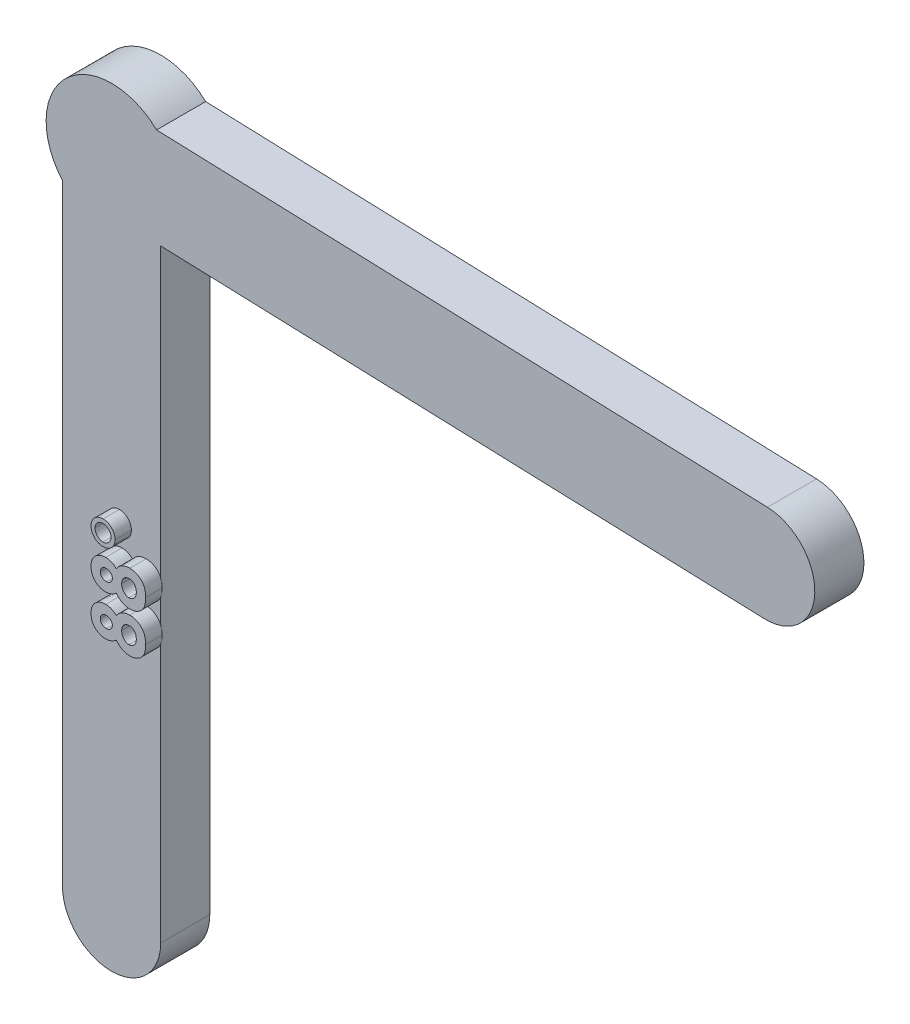
from build123d import *

# Parameters (mm, degrees)
BOSS_EXTRUDE1_DEPTH = 3
BOSS_EXTRUDE2_DEPTH = 1


with BuildPart() as part:
    # Sketch2 → Boss-Extrude1 (new body)
    with BuildSketch(Plane.XY):
        with BuildLine():
            Line((-3, -40), (-3, -2.645751311))
            ThreePointArc((-3, -2.645751311), (-2.778633482, 2.877359201), (2.748838081, 2.905837092))
            Line((2.748838081, 2.905837092), (40.080331571, 1.602192613))
            ThreePointArc((40.080331571, 1.602192613), (42.973805562, -1.500678358), (39.870934591, -4.394152349))
            Line((39.870934591, -4.394152349), (3, -3.106590941))
            Line((3, -3.106590941), (3, -40))
            ThreePointArc((3, -40), (0, -43), (-3, -40))
        make_face()
    extrude(amount=BOSS_EXTRUDE1_DEPTH)

    # Sketch3 → Boss-Extrude2 (add)
    # profile 1 of 3: a face of its own
    with BuildSketch(Plane.XY.offset(3)):
        with BuildLine():
            add(Edge.make_bspline(
                [(1.290384615, -23.026312298), (1.314166509, -22.993008974), (1.361240621, -22.927088051), (1.445595377, -22.840312384), (1.539140341, -22.764908234), (1.642399085, -22.703054927), (1.752431528, -22.653094384), (1.868089089, -22.617736659), (1.988052111, -22.594977779), (2.069615292, -22.592519139), (2.110847356, -22.59127624)],
                knots=[0, 0, 0, 0, 1.013621193, 2.006371702, 2.99000395, 3.985409788, 4.983103806, 5.979189713, 6.978433935, 8, 8, 8, 8], degree=3))
            add(Edge.make_bspline(
                [(2.110847356, -22.59127624), (2.155493061, -22.592781497), (2.244042089, -22.595766983), (2.373883227, -22.622228362), (2.498505826, -22.664489075), (2.616432852, -22.722790764), (2.724431839, -22.795543989), (2.820760825, -22.879876944), (2.901500204, -22.977055898), (2.956541404, -23.067179102), (2.992613836, -23.145046893), (3.017147677, -23.207283527), (3.036374539, -23.273881176), (3.053202037, -23.343847379), (3.065563353, -23.418056754), (3.075401317, -23.495886787), (3.080155908, -23.577892248), (3.08098502, -23.633704691), (3.081410256, -23.662329926)],
                knots=[0, 0, 0, 0, 1.313695232, 2.605545886, 3.885009818, 5.18064216, 6.467307036, 7.710187626, 8.938110693, 10.173834898, 10.807905002, 11.46418112, 12.141763502, 12.847499418, 13.582459421, 14.356129027, 15.156887083, 16, 16, 16, 16], degree=3))
            add(Edge.make_bspline(
                [(3.081410256, -23.662329926), (3.080993787, -23.692863796), (3.080180505, -23.752490423), (3.075321583, -23.839540967), (3.066194522, -23.921622372), (3.054699341, -23.99910139), (3.037672832, -24.071285294), (3.018972292, -24.139263577), (2.996206942, -24.202310994), (2.960636755, -24.279023169), (2.907185797, -24.367493207), (2.828023569, -24.462370692), (2.734597618, -24.546705576), (2.627697323, -24.618514286), (2.509788283, -24.676430737), (2.383511061, -24.71879451), (2.249446964, -24.744074642), (2.157597072, -24.747105427), (2.110847356, -24.748648035)],
                knots=[0, 0, 0, 0, 0.887120363, 1.732371145, 2.531576131, 3.285973923, 4.006155245, 4.684676743, 5.333503306, 5.950809733, 7.13915648, 8.324434623, 9.528022799, 10.783613014, 12.053458699, 13.333110172, 14.642607612, 16, 16, 16, 16], degree=3))
            add(Edge.make_bspline(
                [(2.110847356, -24.748648035), (2.070068436, -24.747233147), (1.989932921, -24.744452722), (1.872494733, -24.724594426), (1.761018818, -24.690327971), (1.654672452, -24.643827956), (1.553870674, -24.583518012), (1.459741575, -24.508877523), (1.370281849, -24.421927441), (1.317458785, -24.355782454), (1.290384615, -24.321880206)],
                knots=[0, 0, 0, 0, 1.018125035, 2.000738969, 2.963689272, 3.92372463, 4.892478514, 5.887985778, 6.917498794, 8, 8, 8, 8], degree=3))
            add(Edge.make_bspline(
                [(1.290384615, -24.321880206), (1.266151716, -24.342893833), (1.218444435, -24.384263335), (1.141646952, -24.437762229), (1.062364505, -24.483056938), (0.981097768, -24.521025414), (0.89711666, -24.549380641), (0.811521784, -24.57095544), (0.723184578, -24.582965773), (0.663516636, -24.584867142), (0.633378405, -24.585827522)],
                knots=[0, 0, 0, 0, 1.061588578, 2.089948196, 3.093099862, 4.082597858, 5.055037947, 6.023898163, 7.001872498, 8, 8, 8, 8], degree=3))
            add(Edge.make_bspline(
                [(0.633378405, -24.585827522), (0.592576327, -24.584567419), (0.512075397, -24.582081284), (0.394207452, -24.559799021), (0.28205246, -24.523313199), (0.176290436, -24.473083604), (0.079075037, -24.409879466), (-0.007396026, -24.333735576), (-0.081993722, -24.245932944), (-0.145475268, -24.147619637), (-0.195029291, -24.038917015), (-0.230531324, -23.921499145), (-0.252811348, -23.796100346), (-0.25519237, -23.709702335), (-0.256410256, -23.665510014)],
                knots=[0, 0, 0, 0, 1.02226196, 2.016883474, 2.9952073, 3.972418565, 4.944004294, 5.893096802, 6.850754418, 7.823909284, 8.818133006, 9.835407617, 10.892817559, 12, 12, 12, 12], degree=3))
            add(Edge.make_bspline(
                [(-0.256410256, -23.665510014), (-0.255190422, -23.621954272), (-0.252812, -23.537029695), (-0.230679106, -23.413833393), (-0.194395909, -23.298961942), (-0.143773179, -23.192659656), (-0.08015754, -23.095369151), (-0.003012872, -23.009068937), (0.085649386, -22.933160951), (0.185372183, -22.869432052), (0.292865784, -22.818185328), (0.405795355, -22.780740272), (0.522920147, -22.758782336), (0.602336048, -22.755664859), (0.642282652, -22.754096753)],
                knots=[0, 0, 0, 0, 1.094451292, 2.133950859, 3.135435022, 4.115505557, 5.085475983, 6.048403322, 7.01637925, 8.011600517, 9.015508126, 10.003420448, 10.995710276, 12, 12, 12, 12], degree=3))
            add(Edge.make_bspline(
                [(0.642282652, -22.754096753), (0.670513068, -22.754855448), (0.725913147, -22.75634433), (0.807533099, -22.767352823), (0.885847553, -22.785889774), (0.962749047, -22.811734482), (1.040327423, -22.847667448), (1.120069223, -22.896293105), (1.205287736, -22.955439833), (1.261061511, -23.001890713), (1.290384615, -23.026312298)],
                knots=[0, 0, 0, 0, 0.940746401, 1.846144481, 2.739104268, 3.619506754, 4.545839139, 5.581956076, 6.728711598, 8, 8, 8, 8], degree=3))
        make_face()
        with BuildLine():
            add(Edge.make_bspline(
                [(0.313461538, -23.679502402), (0.314577296, -23.702973319), (0.316747691, -23.748629438), (0.336791099, -23.813541523), (0.368396801, -23.872433315), (0.413289247, -23.923114863), (0.468001453, -23.964250594), (0.530415435, -23.994987219), (0.600152328, -24.013045), (0.648960581, -24.014966618), (0.674083534, -24.015955727)],
                knots=[0, 0, 0, 0, 1.01773081, 1.979711282, 2.923920718, 3.903393177, 4.896680191, 5.881555186, 6.909578104, 8, 8, 8, 8], degree=3))
            add(Edge.make_bspline(
                [(0.674083534, -24.015955727), (0.699424417, -24.01473849), (0.748904934, -24.012361717), (0.819934691, -23.993640737), (0.884396564, -23.961808124), (0.940626067, -23.917742023), (0.987659679, -23.865222688), (1.021570733, -23.804874205), (1.04308292, -23.738821656), (1.045116089, -23.692389641), (1.046153846, -23.668690102)],
                knots=[0, 0, 0, 0, 1.070748338, 2.090739333, 3.08117878, 4.090911184, 5.094654374, 6.042199979, 7.000711936, 8, 8, 8, 8], degree=3))
            add(Edge.make_bspline(
                [(1.046153846, -23.668690102), (1.045059816, -23.644589035), (1.042928441, -23.597635633), (1.022508887, -23.530660856), (0.988689983, -23.470865504), (0.94229789, -23.419403424), (0.886359471, -23.376357543), (0.820898298, -23.345507755), (0.747532717, -23.327585015), (0.696233661, -23.325203523), (0.66963141, -23.323968548)],
                knots=[0, 0, 0, 0, 1.009150293, 1.966014103, 2.906107826, 3.870180916, 4.854078599, 5.848854597, 6.884476363, 8, 8, 8, 8], degree=3))
            add(Edge.make_bspline(
                [(0.66963141, -23.323968548), (0.644523092, -23.325237857), (0.595964488, -23.327692656), (0.526250213, -23.345294507), (0.464864053, -23.377621187), (0.410961323, -23.420094273), (0.367492124, -23.473344141), (0.335524613, -23.535163337), (0.316983147, -23.605096651), (0.314660828, -23.654163397), (0.313461538, -23.679502402)],
                knots=[0, 0, 0, 0, 1.065910571, 2.061433587, 3.023559535, 3.990682701, 4.956464619, 5.918590567, 6.925120432, 8, 8, 8, 8], degree=3))
        make_face(mode=Mode.SUBTRACT)
        with BuildLine():
            add(Edge.make_bspline(
                [(1.616025641, -23.661057891), (1.616315036, -23.678890032), (1.616885429, -23.71403696), (1.623711201, -23.765668253), (1.633401384, -23.815418524), (1.648498508, -23.86241607), (1.666134775, -23.907905955), (1.689165374, -23.950739891), (1.715918448, -23.991651788), (1.74640318, -24.029758844), (1.779830517, -24.064209477), (1.814702344, -24.095260775), (1.851910211, -24.12064149), (1.890219827, -24.141777404), (1.929934133, -24.158760273), (1.971707306, -24.169987223), (2.014983002, -24.17721581), (2.044460653, -24.178253037), (2.059329928, -24.17877624)],
                knots=[0, 0, 0, 0, 1.129662435, 2.226550525, 3.296682235, 4.33815786, 5.351414921, 6.385493299, 7.41431807, 8.4469981, 9.473537958, 10.454642902, 11.401552439, 12.321859429, 13.225429467, 14.131893492, 15.057679712, 16, 16, 16, 16], degree=3))
            add(Edge.make_bspline(
                [(2.059329928, -24.17877624), (2.074837113, -24.178526872), (2.105593696, -24.178032281), (2.150485415, -24.170562185), (2.193780386, -24.159806562), (2.235073386, -24.14469996), (2.274340207, -24.124497697), (2.311963245, -24.100376027), (2.347676229, -24.071492898), (2.381297203, -24.038635081), (2.411600958, -24.001839599), (2.438404735, -23.962224083), (2.461677906, -23.920046731), (2.479861546, -23.874906877), (2.49411916, -23.826983606), (2.503888336, -23.776485051), (2.510720881, -23.72314812), (2.511261264, -23.686733504), (2.511538462, -23.668054084)],
                knots=[0, 0, 0, 0, 0.973751152, 1.931314908, 2.852573969, 3.776047714, 4.688004804, 5.623328242, 6.580799242, 7.570383313, 8.573782212, 9.57185612, 10.573837789, 11.596003268, 12.62492379, 13.712263769, 14.826471634, 16, 16, 16, 16], degree=3))
            add(Edge.make_bspline(
                [(2.511538462, -23.668054084), (2.511196157, -23.649169628), (2.510529115, -23.612369803), (2.504633754, -23.558575838), (2.495279457, -23.507696372), (2.481900889, -23.459791822), (2.464761533, -23.414682299), (2.442949692, -23.372968368), (2.418219634, -23.333714205), (2.389368786, -23.298121162), (2.357892778, -23.265910593), (2.323956282, -23.237529703), (2.287463312, -23.213770107), (2.248401199, -23.194887945), (2.207627439, -23.179355669), (2.164524234, -23.168555886), (2.119106345, -23.162037403), (2.087973171, -23.16144898), (2.07205028, -23.161148035)],
                knots=[0, 0, 0, 0, 1.200550576, 2.339492856, 3.436821733, 4.486835684, 5.498320788, 6.499238723, 7.475334368, 8.44385928, 9.406737867, 10.335409062, 11.251568017, 12.168024507, 13.089524389, 14.021419298, 14.988065767, 16, 16, 16, 16], degree=3))
            add(Edge.make_bspline(
                [(2.07205028, -23.161148035), (2.056133401, -23.161729858), (2.025021417, -23.162867119), (1.979077259, -23.16909005), (1.935521469, -23.180763628), (1.893343926, -23.196036093), (1.853417246, -23.21635192), (1.81582637, -23.241573801), (1.779637539, -23.270281659), (1.746471676, -23.303838066), (1.716116677, -23.340514587), (1.689182565, -23.379595701), (1.666011589, -23.420681204), (1.64851655, -23.464780182), (1.633396343, -23.510493081), (1.62371115, -23.558984292), (1.616884013, -23.609345873), (1.616314611, -23.643649093), (1.616025641, -23.661057891)],
                knots=[0, 0, 0, 0, 1.011783362, 1.977685852, 2.938313235, 3.871729441, 4.823627117, 5.776382316, 6.744161804, 7.753880392, 8.768082256, 9.765777265, 10.766741032, 11.757408326, 12.775628261, 13.821889533, 14.89461443, 16, 16, 16, 16], degree=3))
        make_face(mode=Mode.SUBTRACT)
    # profile 2 of 3: a face of its own
    with BuildSketch(Plane.XY.offset(3)):
        with BuildLine():
            add(Edge.make_bspline(
                [(1.290384615, -20.543299477), (1.314166509, -20.509996154), (1.361240621, -20.44407523), (1.445595377, -20.357299563), (1.539140341, -20.281895414), (1.642399085, -20.220042107), (1.752431528, -20.170081563), (1.868089089, -20.134723838), (1.988052111, -20.111964958), (2.069615292, -20.109506318), (2.110847356, -20.108263419)],
                knots=[0, 0, 0, 0, 1.013621193, 2.006371702, 2.99000395, 3.985409788, 4.983103806, 5.979189713, 6.978433935, 8, 8, 8, 8], degree=3))
            add(Edge.make_bspline(
                [(2.110847356, -20.108263419), (2.155493061, -20.109768677), (2.244042089, -20.112754162), (2.373883227, -20.139215541), (2.498505826, -20.181476255), (2.616432852, -20.239777943), (2.724431839, -20.312531169), (2.820760825, -20.396864123), (2.901500204, -20.494043078), (2.956541404, -20.584166281), (2.992613836, -20.662034073), (3.017147677, -20.724270707), (3.036374539, -20.790868356), (3.053202037, -20.860834558), (3.065563353, -20.935043934), (3.075401317, -21.012873967), (3.080155908, -21.094879427), (3.08098502, -21.150691871), (3.081410256, -21.179317105)],
                knots=[0, 0, 0, 0, 1.313695232, 2.605545886, 3.885009818, 5.18064216, 6.467307036, 7.710187626, 8.938110693, 10.173834898, 10.807905002, 11.46418112, 12.141763502, 12.847499418, 13.582459421, 14.356129027, 15.156887083, 16, 16, 16, 16], degree=3))
            add(Edge.make_bspline(
                [(3.081410256, -21.179317105), (3.080993787, -21.209850975), (3.080180505, -21.269477602), (3.075321583, -21.356528146), (3.066194522, -21.438609551), (3.054699341, -21.51608857), (3.037672832, -21.588272474), (3.018972292, -21.656250757), (2.996206942, -21.719298173), (2.960636755, -21.796010348), (2.907185797, -21.884480386), (2.828023569, -21.979357872), (2.734597618, -22.063692755), (2.627697323, -22.135501465), (2.509788283, -22.193417916), (2.383511061, -22.235781689), (2.249446964, -22.261061822), (2.157597072, -22.264092607), (2.110847356, -22.265635214)],
                knots=[0, 0, 0, 0, 0.887120363, 1.732371145, 2.531576131, 3.285973923, 4.006155245, 4.684676743, 5.333503306, 5.950809733, 7.13915648, 8.324434623, 9.528022799, 10.783613014, 12.053458699, 13.333110172, 14.642607612, 16, 16, 16, 16], degree=3))
            add(Edge.make_bspline(
                [(2.110847356, -22.265635214), (2.070068436, -22.264220327), (1.989932921, -22.261439901), (1.872494733, -22.241581605), (1.761018818, -22.20731515), (1.654672452, -22.160815136), (1.553870674, -22.100505192), (1.459741575, -22.025864702), (1.370281849, -21.938914621), (1.317458785, -21.872769633), (1.290384615, -21.838867386)],
                knots=[0, 0, 0, 0, 1.018125035, 2.000738969, 2.963689272, 3.92372463, 4.892478514, 5.887985778, 6.917498794, 8, 8, 8, 8], degree=3))
            add(Edge.make_bspline(
                [(1.290384615, -21.838867386), (1.266151716, -21.859881012), (1.218444435, -21.901250514), (1.141646952, -21.954749408), (1.062364505, -22.000044117), (0.981097768, -22.038012593), (0.89711666, -22.06636782), (0.811521784, -22.087942619), (0.723184578, -22.099952953), (0.663516636, -22.101854322), (0.633378405, -22.102814701)],
                knots=[0, 0, 0, 0, 1.061588578, 2.089948196, 3.093099862, 4.082597858, 5.055037947, 6.023898163, 7.001872498, 8, 8, 8, 8], degree=3))
            add(Edge.make_bspline(
                [(0.633378405, -22.102814701), (0.592576327, -22.101554598), (0.512075397, -22.099068463), (0.394207452, -22.0767862), (0.28205246, -22.040300379), (0.176290436, -21.990070784), (0.079075037, -21.926866646), (-0.007396026, -21.850722756), (-0.081993722, -21.762920124), (-0.145475268, -21.664606816), (-0.195029291, -21.555904195), (-0.230531324, -21.438486325), (-0.252811348, -21.313087526), (-0.25519237, -21.226689514), (-0.256410256, -21.182497193)],
                knots=[0, 0, 0, 0, 1.02226196, 2.016883474, 2.9952073, 3.972418565, 4.944004294, 5.893096802, 6.850754418, 7.823909284, 8.818133006, 9.835407617, 10.892817559, 12, 12, 12, 12], degree=3))
            add(Edge.make_bspline(
                [(-0.256410256, -21.182497193), (-0.255190422, -21.138941451), (-0.252812, -21.054016874), (-0.230679106, -20.930820572), (-0.194395909, -20.815949122), (-0.143773179, -20.709646835), (-0.08015754, -20.61235633), (-0.003012872, -20.526056117), (0.085649386, -20.45014813), (0.185372183, -20.386419232), (0.292865784, -20.335172507), (0.405795355, -20.297727452), (0.522920147, -20.275769515), (0.602336048, -20.272652039), (0.642282652, -20.271083932)],
                knots=[0, 0, 0, 0, 1.094451292, 2.133950859, 3.135435022, 4.115505557, 5.085475983, 6.048403322, 7.01637925, 8.011600517, 9.015508126, 10.003420448, 10.995710276, 12, 12, 12, 12], degree=3))
            add(Edge.make_bspline(
                [(0.642282652, -20.271083932), (0.670513068, -20.271842627), (0.725913147, -20.273331509), (0.807533099, -20.284340002), (0.885847553, -20.302876954), (0.962749047, -20.328721661), (1.040327423, -20.364654627), (1.120069223, -20.413280285), (1.205287736, -20.472427012), (1.261061511, -20.518877892), (1.290384615, -20.543299477)],
                knots=[0, 0, 0, 0, 0.940746401, 1.846144481, 2.739104268, 3.619506754, 4.545839139, 5.581956076, 6.728711598, 8, 8, 8, 8], degree=3))
        make_face()
        with BuildLine():
            add(Edge.make_bspline(
                [(0.313461538, -21.196489581), (0.314577296, -21.219960498), (0.316747691, -21.265616618), (0.336791099, -21.330528702), (0.368396801, -21.389420495), (0.413289247, -21.440102042), (0.468001453, -21.481237774), (0.530415435, -21.511974398), (0.600152328, -21.53003218), (0.648960581, -21.531953797), (0.674083534, -21.532942907)],
                knots=[0, 0, 0, 0, 1.01773081, 1.979711282, 2.923920718, 3.903393177, 4.896680191, 5.881555186, 6.909578104, 8, 8, 8, 8], degree=3))
            add(Edge.make_bspline(
                [(0.674083534, -21.532942907), (0.699424417, -21.531725669), (0.748904934, -21.529348897), (0.819934691, -21.510627917), (0.884396564, -21.478795303), (0.940626067, -21.434729202), (0.987659679, -21.382209868), (1.021570733, -21.321861385), (1.04308292, -21.255808835), (1.045116089, -21.209376821), (1.046153846, -21.185677282)],
                knots=[0, 0, 0, 0, 1.070748338, 2.090739333, 3.08117878, 4.090911184, 5.094654374, 6.042199979, 7.000711936, 8, 8, 8, 8], degree=3))
            add(Edge.make_bspline(
                [(1.046153846, -21.185677282), (1.045059816, -21.161576214), (1.042928441, -21.114622813), (1.022508887, -21.047648035), (0.988689983, -20.987852684), (0.94229789, -20.936390604), (0.886359471, -20.893344723), (0.820898298, -20.862494934), (0.747532717, -20.844572194), (0.696233661, -20.842190702), (0.66963141, -20.840955727)],
                knots=[0, 0, 0, 0, 1.009150293, 1.966014103, 2.906107826, 3.870180916, 4.854078599, 5.848854597, 6.884476363, 8, 8, 8, 8], degree=3))
            add(Edge.make_bspline(
                [(0.66963141, -20.840955727), (0.644523092, -20.842225036), (0.595964488, -20.844679836), (0.526250213, -20.862281686), (0.464864053, -20.894608366), (0.410961323, -20.937081453), (0.367492124, -20.99033132), (0.335524613, -21.052150516), (0.316983147, -21.12208383), (0.314660828, -21.171150577), (0.313461538, -21.196489581)],
                knots=[0, 0, 0, 0, 1.065910571, 2.061433587, 3.023559535, 3.990682701, 4.956464619, 5.918590567, 6.925120432, 8, 8, 8, 8], degree=3))
        make_face(mode=Mode.SUBTRACT)
        with BuildLine():
            add(Edge.make_bspline(
                [(1.616025641, -21.17804507), (1.616315036, -21.195877211), (1.616885429, -21.231024139), (1.623711201, -21.282655433), (1.633401384, -21.332405703), (1.648498508, -21.379403249), (1.666134775, -21.424893135), (1.689165374, -21.467727071), (1.715918448, -21.508638967), (1.74640318, -21.546746023), (1.779830517, -21.581196657), (1.814702344, -21.612247955), (1.851910211, -21.63762867), (1.890219827, -21.658764583), (1.929934133, -21.675747453), (1.971707306, -21.686974403), (2.014983002, -21.69420299), (2.044460653, -21.695240216), (2.059329928, -21.695763419)],
                knots=[0, 0, 0, 0, 1.129662435, 2.226550525, 3.296682235, 4.33815786, 5.351414921, 6.385493299, 7.41431807, 8.4469981, 9.473537958, 10.454642902, 11.401552439, 12.321859429, 13.225429467, 14.131893492, 15.057679712, 16, 16, 16, 16], degree=3))
            add(Edge.make_bspline(
                [(2.059329928, -21.695763419), (2.074837113, -21.695514051), (2.105593696, -21.695019461), (2.150485415, -21.687549364), (2.193780386, -21.676793741), (2.235073386, -21.661687139), (2.274340207, -21.641484876), (2.311963245, -21.617363206), (2.347676229, -21.588480078), (2.381297203, -21.555622261), (2.411600958, -21.518826779), (2.438404735, -21.479211262), (2.461677906, -21.437033911), (2.479861546, -21.391894056), (2.49411916, -21.343970785), (2.503888336, -21.29347223), (2.510720881, -21.2401353), (2.511261264, -21.203720684), (2.511538462, -21.185041264)],
                knots=[0, 0, 0, 0, 0.973751152, 1.931314908, 2.852573969, 3.776047714, 4.688004804, 5.623328242, 6.580799242, 7.570383313, 8.573782212, 9.57185612, 10.573837789, 11.596003268, 12.62492379, 13.712263769, 14.826471634, 16, 16, 16, 16], degree=3))
            add(Edge.make_bspline(
                [(2.511538462, -21.185041264), (2.511196157, -21.166156807), (2.510529115, -21.129356982), (2.504633754, -21.075563017), (2.495279457, -21.024683551), (2.481900889, -20.976779001), (2.464761533, -20.931669479), (2.442949692, -20.889955547), (2.418219634, -20.850701385), (2.389368786, -20.815108342), (2.357892778, -20.782897773), (2.323956282, -20.754516883), (2.287463312, -20.730757287), (2.248401199, -20.711875125), (2.207627439, -20.696342848), (2.164524234, -20.685543065), (2.119106345, -20.679024582), (2.087973171, -20.67843616), (2.07205028, -20.678135214)],
                knots=[0, 0, 0, 0, 1.200550576, 2.339492856, 3.436821733, 4.486835684, 5.498320788, 6.499238723, 7.475334368, 8.44385928, 9.406737867, 10.335409062, 11.251568017, 12.168024507, 13.089524389, 14.021419298, 14.988065767, 16, 16, 16, 16], degree=3))
            add(Edge.make_bspline(
                [(2.07205028, -20.678135214), (2.056133401, -20.678717037), (2.025021417, -20.679854299), (1.979077259, -20.686077229), (1.935521469, -20.697750807), (1.893343926, -20.713023273), (1.853417246, -20.733339099), (1.81582637, -20.75856098), (1.779637539, -20.787268838), (1.746471676, -20.820825245), (1.716116677, -20.857501767), (1.689182565, -20.896582881), (1.666011589, -20.937668384), (1.64851655, -20.981767361), (1.633396343, -21.02748026), (1.62371115, -21.075971471), (1.616884013, -21.126333052), (1.616314611, -21.160636272), (1.616025641, -21.17804507)],
                knots=[0, 0, 0, 0, 1.011783362, 1.977685852, 2.938313235, 3.871729441, 4.823627117, 5.776382316, 6.744161804, 7.753880392, 8.768082256, 9.765777265, 10.766741032, 11.757408326, 12.775628261, 13.821889533, 14.89461443, 16, 16, 16, 16], degree=3))
        make_face(mode=Mode.SUBTRACT)
    # profile 3 of 3: a face of its own
    with BuildSketch(Plane.XY.offset(3)):
        with BuildLine():
            add(Edge.make_bspline(
                [(0.476282051, -18.317237778), (0.501543872, -18.317784273), (0.55122174, -18.318858966), (0.624352745, -18.329292265), (0.694208258, -18.34677148), (0.761803607, -18.369182127), (0.825395964, -18.400320878), (0.886396731, -18.437182627), (0.943669883, -18.481681462), (0.9978957, -18.531293758), (1.047295391, -18.585793921), (1.090947065, -18.643684278), (1.127096601, -18.705143258), (1.157366856, -18.768856038), (1.180332148, -18.835687452), (1.196689885, -18.905143376), (1.20741609, -18.977515776), (1.208449037, -19.026782661), (1.208974359, -19.051838139)],
                knots=[0, 0, 0, 0, 1.048753193, 2.062393874, 3.059725798, 4.03711221, 5.013824111, 5.993903926, 6.992478922, 8.020738441, 9.043061753, 10.043343452, 11.026424807, 11.999358773, 12.968420071, 13.955122655, 14.960044262, 16, 16, 16, 16], degree=3))
            add(Edge.make_bspline(
                [(1.208974359, -19.051838139), (1.208454225, -19.076895472), (1.207431478, -19.126166003), (1.196631189, -19.198511918), (1.180530583, -19.268133933), (1.156529218, -19.33467048), (1.126678292, -19.39843532), (1.090260147, -19.459351606), (1.046482503, -19.516879783), (0.996781055, -19.570861587), (0.942375086, -19.620386427), (0.88420218, -19.663761702), (0.823225465, -19.701224906), (0.758107997, -19.730116226), (0.69067286, -19.754225828), (0.619758864, -19.770266629), (0.545943315, -19.781111895), (0.495615647, -19.782111875), (0.469921875, -19.782622394)],
                knots=[0, 0, 0, 0, 1.037227242, 2.039512271, 3.023626077, 3.993053151, 4.963434463, 5.936395473, 6.927031705, 7.952593414, 8.972234493, 9.969891786, 10.954906455, 11.929570282, 12.915563215, 13.916770353, 14.936449251, 16, 16, 16, 16], degree=3))
            add(Edge.make_bspline(
                [(0.469921875, -19.782622394), (0.445290866, -19.782090241), (0.396869022, -19.781044087), (0.325492116, -19.77038245), (0.256787066, -19.753461564), (0.190979117, -19.729094019), (0.128167681, -19.698009038), (0.067236284, -19.661458925), (0.010175979, -19.616216201), (-0.044275745, -19.565794512), (-0.093962638, -19.510497298), (-0.137555056, -19.451801169), (-0.173973759, -19.390300809), (-0.203993097, -19.326413212), (-0.227847104, -19.260047352), (-0.244158222, -19.190690009), (-0.254789074, -19.118950322), (-0.255866772, -19.070108802), (-0.256410256, -19.045477963)],
                knots=[0, 0, 0, 0, 1.027628768, 2.020204677, 3.0054932, 3.977172113, 4.942988595, 5.928118098, 6.937247537, 7.976812879, 9.023474825, 10.036014018, 11.024160528, 12.002107364, 12.979092523, 13.962271943, 14.972371232, 16, 16, 16, 16], degree=3))
            add(Edge.make_bspline(
                [(-0.256410256, -19.045477963), (-0.255881051, -19.020844962), (-0.254836181, -18.972209197), (-0.244068832, -18.900705936), (-0.227959354, -18.831719293), (-0.203981879, -18.765803019), (-0.173948227, -18.702563906), (-0.137706982, -18.641780122), (-0.093944483, -18.584220638), (-0.043999627, -18.530298054), (0.009956511, -18.480065971), (0.068273488, -18.436906382), (0.128824771, -18.399383463), (0.192846684, -18.369733854), (0.259342082, -18.345673684), (0.329176204, -18.329512767), (0.401748506, -18.318822345), (0.451226198, -18.31777046), (0.476282051, -18.317237778)],
                knots=[0, 0, 0, 0, 1.02774298, 2.029191086, 3.012479778, 3.981238486, 4.951290381, 5.931946007, 6.930416638, 7.964088953, 8.997761269, 10.003308488, 10.98854748, 11.966603007, 12.943696749, 13.935593372, 14.954569896, 16, 16, 16, 16], degree=3))
        make_face()
        with BuildLine():
            add(Edge.make_bspline(
                [(0.479462139, -18.561468548), (0.462471258, -18.561703053), (0.428972226, -18.562165401), (0.379883793, -18.569784767), (0.332524379, -18.580302564), (0.287283463, -18.595562709), (0.24427911, -18.615513073), (0.203398935, -18.639850618), (0.164484674, -18.668453688), (0.128492582, -18.701516313), (0.095853701, -18.737382636), (0.066652511, -18.775176041), (0.042455186, -18.815365312), (0.023016589, -18.857551883), (0.006315159, -18.901080648), (-0.003707976, -18.946990714), (-0.01154919, -18.994542088), (-0.011966436, -19.026997687), (-0.012179487, -19.04356991)],
                knots=[0, 0, 0, 0, 1.061159961, 2.092171217, 3.098605391, 4.092036902, 5.070589041, 6.057187883, 7.061962211, 8.084674938, 9.107387665, 10.090954379, 11.06617917, 12.032717429, 12.99305519, 13.973669989, 14.965331307, 16, 16, 16, 16], degree=3))
            add(Edge.make_bspline(
                [(-0.012179487, -19.04356991), (-0.01157068, -19.060330201), (-0.01036426, -19.093542585), (-0.004409395, -19.142479621), (0.007572839, -19.1891325), (0.022606002, -19.234333751), (0.043122897, -19.277176932), (0.067542797, -19.318670025), (0.096744971, -19.357714151), (0.129769422, -19.394493455), (0.165718261, -19.428239253), (0.204573602, -19.457229335), (0.244977971, -19.482631198), (0.287582445, -19.50273415), (0.331832846, -19.518846523), (0.377821945, -19.530488216), (0.425871214, -19.536635112), (0.458458137, -19.537799962), (0.475010016, -19.538391625)],
                knots=[0, 0, 0, 0, 1.042034071, 2.064906527, 3.055369705, 4.030203466, 5.020228521, 6.000742353, 7.017744738, 8.043920206, 9.069249762, 10.075703201, 11.051782302, 12.029903876, 12.99669358, 13.974371501, 14.971122288, 16, 16, 16, 16], degree=3))
            add(Edge.make_bspline(
                [(0.475010016, -19.538391625), (0.491349767, -19.537798935), (0.523514051, -19.536632245), (0.570936909, -19.530501951), (0.616468237, -19.518744628), (0.660506807, -19.502704188), (0.703332854, -19.482737173), (0.743356347, -19.456508049), (0.782721478, -19.42729797), (0.819574977, -19.393217113), (0.853594861, -19.356337508), (0.883277913, -19.316841991), (0.908722399, -19.275901192), (0.929101491, -19.232915136), (0.945194342, -19.188652543), (0.956841315, -19.142666742), (0.962986781, -19.094616579), (0.964151827, -19.062029779), (0.96474359, -19.045477963)],
                knots=[0, 0, 0, 0, 1.017878107, 2.003660885, 2.970612419, 3.939454555, 4.919652619, 5.904816436, 6.913406512, 7.969270601, 9.02513469, 10.033724766, 11.041277553, 12.021475617, 12.990317753, 13.970071221, 14.968938047, 16, 16, 16, 16], degree=3))
            add(Edge.make_bspline(
                [(0.96474359, -19.045477963), (0.964515736, -19.029119477), (0.964066668, -18.996879157), (0.956359019, -18.949727679), (0.946146284, -18.904068077), (0.929505189, -18.860764441), (0.910263551, -18.818312687), (0.884925795, -18.778531284), (0.856415485, -18.739675094), (0.822504018, -18.704348446), (0.787116244, -18.670231628), (0.747777121, -18.642044344), (0.707718654, -18.616798937), (0.665616684, -18.59614885), (0.621397497, -18.58134139), (0.575848465, -18.56921827), (0.528165265, -18.563288235), (0.49579822, -18.56207891), (0.479462139, -18.561468548)],
                knots=[0, 0, 0, 0, 1.029744634, 2.029484694, 3.00508751, 3.97324883, 4.947661161, 5.937798898, 6.940036528, 7.980134083, 9.020231638, 10.033191535, 11.023329272, 12.003497406, 12.979740652, 13.958541426, 14.969648588, 16, 16, 16, 16], degree=3))
        make_face(mode=Mode.SUBTRACT)
    extrude(amount=BOSS_EXTRUDE2_DEPTH)


solid = part.part
